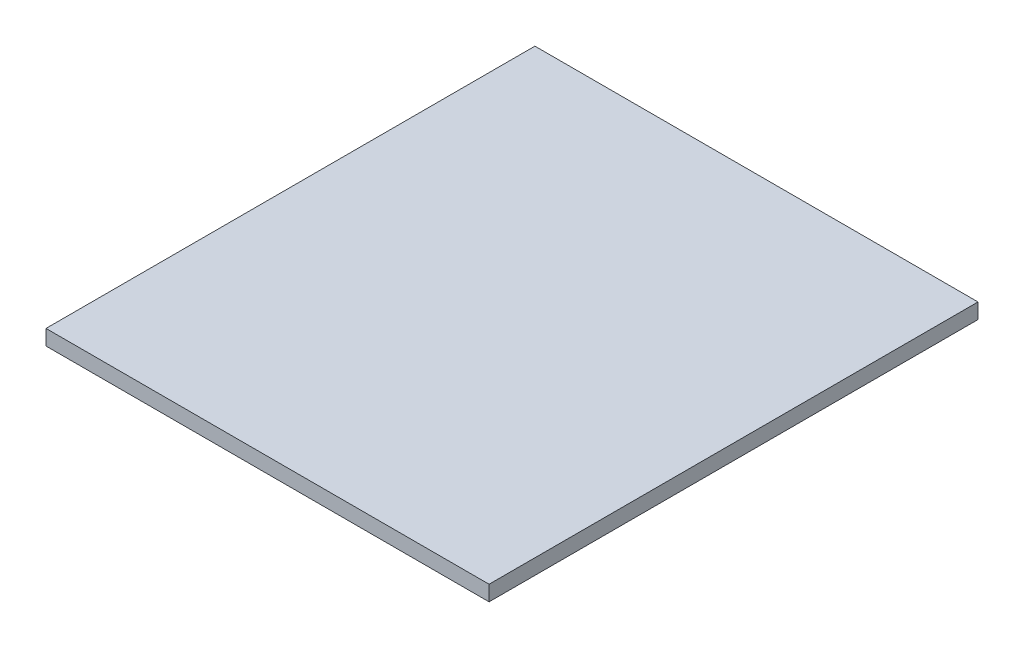
from build123d import *

# Parameters (mm, degrees)
PRESS_KOVA_TABANI_1_START = -140
SKETCH1_W                 = 290
SKETCH1_H                 = 10
PRESS_KOVA_TABANI_1_DEPTH = 320


with BuildPart() as part:
    # Sketch1 → PRESS_kova_tabani_1 (new body)
    with BuildSketch(Plane.XY.offset(PRESS_KOVA_TABANI_1_START)):
        with Locations((185, 1305)):
            Rectangle(SKETCH1_W, SKETCH1_H)
    extrude(amount=-PRESS_KOVA_TABANI_1_DEPTH)


solid = part.part
